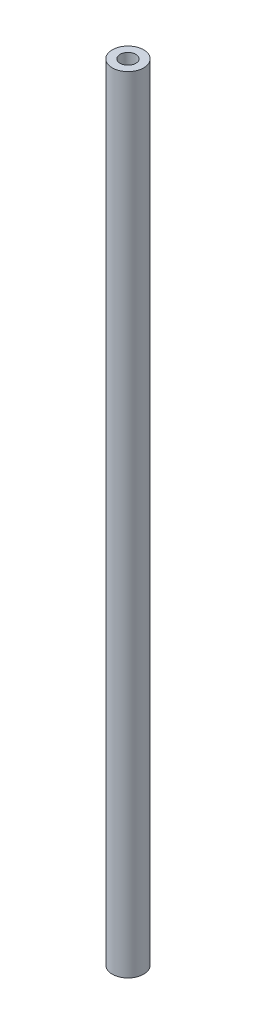
from build123d import *

# Parameters (mm, degrees)
SKETCH_1_R          = 4
EXTRUDE_1_DEPTH     = 200
SKETCH_2_R          = 2
CUT_EXTRUDE_1_DEPTH = 201.079984006


with BuildPart() as part:
    # 草图1 → 凸台-拉伸1 (new body)
    with BuildSketch(Plane(origin=(0, 0, 0), x_dir=(1, 0, 0), z_dir=(0, 1, 0))):
        with Locations(Location((0, 0, 0), (0, 0, 270))):
            Circle(SKETCH_1_R)
    extrude(amount=EXTRUDE_1_DEPTH)

    # 草图2 → 切除-拉伸1 (cut, through all)
    with BuildSketch(Plane(origin=(0, 200, 0), x_dir=(1, 0, 0), z_dir=(0, 1, 0))):
        with Locations(Location((0, 0, 0), (0, 0, 270))):
            Circle(SKETCH_2_R)
    extrude(amount=-CUT_EXTRUDE_1_DEPTH, mode=Mode.SUBTRACT)


solid = part.part
